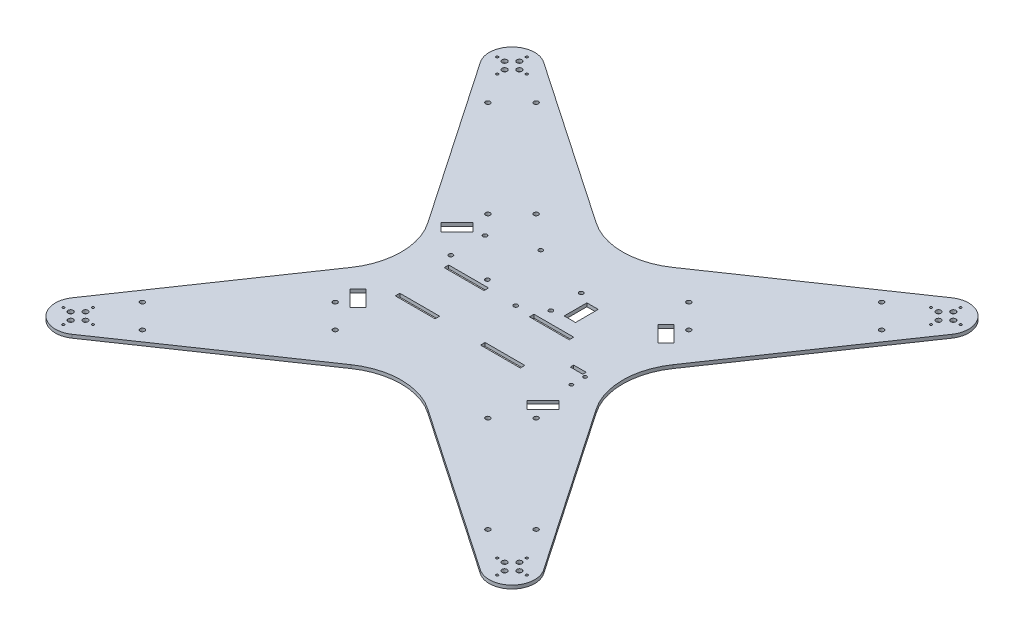
from build123d import *

# Parameters (mm, degrees)
SKETCH1_R           = 1
SKETCH1_R_2         = 2.25
SKETCH1_R_3         = 2
BOSS_EXTRUDE1_DEPTH = 3
CIRPATTERN1_COUNT   = 4
SKETCH2_R           = 1.5
SKETCH2_R_2         = 1.8
SKETCH2_W           = 35
SKETCH2_H           = 4
CUT_EXTRUDE1_DEPTH  = 299.299357146
FILLET1_R           = 60
SKETCH6_W           = 10
SKETCH6_H           = 20
CUT_EXTRUDE2_DEPTH  = 10
SKETCH7_W           = 11
SKETCH7_H           = 3
CUT_EXTRUDE3_DEPTH  = 299.299357146


with BuildPart() as part:
    # Sketch1 → Boss-Extrude1 (new body)
    with BuildSketch(Plane(origin=(0, 0, 0), x_dir=(1, 0, 0), z_dir=(0, 1, 0))):
        with BuildLine():
            Line((0, 84.852813742), (179.645786322, 207.439075031))
            ThreePointArc((179.645786322, 207.439075031), (205.060966544, 205.060966544), (207.439075031, 179.645786322))
            Line((207.439075031, 179.645786322), (84.852813742, 0))
            Line((84.852813742, 0), (0, 0))
            Line((0, 0), (0, 84.852813742))
        make_face()
        with Locations(Location((177.91883092, 190.91883092, 0), (0, 0, 270))):
            Circle(SKETCH1_R, mode=Mode.SUBTRACT)
        with Locations(Location((190.91883092, 203.91883092, 0), (0, 0, 270))):
            Circle(SKETCH1_R, mode=Mode.SUBTRACT)
        with Locations(Location((203.91883092, 190.91883092, 0), (0, 0, 270))):
            Circle(SKETCH1_R, mode=Mode.SUBTRACT)
        with Locations(Location((197.41883092, 190.91883092, 0), (0, 0, 270))):
            Circle(SKETCH1_R_2, mode=Mode.SUBTRACT)
        with Locations(Location((190.91883092, 197.41883092, 0), (0, 0, 270))):
            Circle(SKETCH1_R_2, mode=Mode.SUBTRACT)
        with Locations(Location((184.41883092, 190.91883092, 0), (0, 0, 270))):
            Circle(SKETCH1_R_2, mode=Mode.SUBTRACT)
        with Locations(Location((190.91883092, 184.41883092, 0), (0, 0, 270))):
            Circle(SKETCH1_R_2, mode=Mode.SUBTRACT)
        with Locations(Location((190.91883092, 177.91883092, 0), (0, 0, 270))):
            Circle(SKETCH1_R, mode=Mode.SUBTRACT)
        with Locations(Location((152.027957955, 173.241161391, 0), (0, 0, 270))):
            Circle(SKETCH1_R_3, mode=Mode.SUBTRACT)
        with Locations(Location((173.241161391, 152.027957955, 0), (0, 0, 270))):
            Circle(SKETCH1_R_3, mode=Mode.SUBTRACT)
        with Locations(Location((67.175144213, 88.388347648, 0), (0, 0, 270))):
            Circle(SKETCH1_R_3, mode=Mode.SUBTRACT)
        with Locations(Location((88.388347648, 67.175144213, 0), (0, 0, 270))):
            Circle(SKETCH1_R_3, mode=Mode.SUBTRACT)
    boss_extrude1 = extrude(amount=BOSS_EXTRUDE1_DEPTH)

    # CirPattern1: Boss-Extrude1 ×4 about axis
    cirpattern1_axis = Axis((0, 0, 0), (0, 1, 0))
    for i in range(1, CIRPATTERN1_COUNT):
        add(boss_extrude1.rotate(cirpattern1_axis, i * 360 / CIRPATTERN1_COUNT))

    # Sketch2 → Cut-Extrude1 (cut, through all)
    with BuildSketch(Plane(origin=(0, 3, 0), x_dir=(1, 0, 0), z_dir=(0, 1, 0))):
        with Locations(Location((78.536494873, -14.223633123, 0), (0, 0, 270))):
            Circle(SKETCH2_R)
        with Locations(Location((78.501168955, -26.223633123, 0), (0, 0, 270))):
            Circle(SKETCH2_R)
        with Locations(Location((12.881434281, 21.278805396, 0), (0, 0, 270))):
            Circle(SKETCH2_R_2)
        with Locations(Location((12.881434281, 48.01791892, 0), (0, 0, 270))):
            Circle(SKETCH2_R_2)
        with Locations(Location((-38.485846848, 16.889912116, 0), (0, 0, 270))):
            Circle(SKETCH2_R_2)
        with Locations(Location((-37.569525332, 62.827189776, 0), (0, 0, 270))):
            Circle(SKETCH2_R_2)
        with Locations(Location((-73.242055549, 49.452085076, 0), (0, 0, 270))):
            Circle(SKETCH2_R_2)
        with Locations(Location((-6.306632568, 9.567397571, 0), (0, 0, 270))):
            Circle(SKETCH2_R_2)
        with Locations(Location((-73.242055549, 19.452085076, 0), (0, 0, 270))):
            Circle(SKETCH2_R_2)
        with Locations((-49.231294494, 9.058974397)):
            Rectangle(SKETCH2_W, SKETCH2_H)
        with Locations((25.768705506, 9.058974397)):
            Rectangle(SKETCH2_W, SKETCH2_H)
        with Locations((-49.231294494, -33.973204669)):
            Rectangle(SKETCH2_W, SKETCH2_H)
        with Locations((25.768705506, -33.973204669)):
            Rectangle(SKETCH2_W, SKETCH2_H)
    extrude(amount=-CUT_EXTRUDE1_DEPTH, mode=Mode.SUBTRACT)

    # Fillet1
    fillet1_edges = [part.edges().sort_by_distance(p)[0] for p in [
        (-84.852813742, 1.5, 0),
        (0, 1.5, -84.852813742),
        (0, 1.5, 84.852813742),
        (84.852813742, 1.5, 0),
    ]]
    fillet(fillet1_edges, radius=FILLET1_R)

    # Sketch6 → Cut-Extrude2 (cut)
    with BuildSketch(Plane.XZ):
        Polygon((-91.923881554, 50.639610307), (-77.781745931, 64.781745931), (-70.710678119, 57.710678119), (-84.852813742, 43.568542495), align=None)
        Polygon((-102.530483272, -40.033008589), (-95.45941546, -32.961940777), (-81.317279836, -47.104076401), (-88.388347648, -54.175144213), align=None)
        Polygon((77.781745931, -64.781745931), (70.710678119, -57.710678119), (84.852813742, -43.568542495), (91.923881554, -50.639610307), align=None)
        Polygon((84.852813742, 43.568542495), (70.710678119, 57.710678119), (77.781745931, 64.781745931), (91.923881554, 50.639610307), align=None)
        with Locations((27.881434281, -33.01791892)):
            Rectangle(SKETCH6_W, SKETCH6_H)
    extrude(amount=-CUT_EXTRUDE2_DEPTH, mode=Mode.SUBTRACT)

    # Sketch7 → Cut-Extrude3 (cut, through all)
    with BuildSketch(Plane(origin=(0, 3, 0), x_dir=(1, 0, 0), z_dir=(0, 1, 0))):
        with Locations((70.036494873, -11.723633123)):
            Rectangle(SKETCH7_W, SKETCH7_H)
    extrude(amount=-CUT_EXTRUDE3_DEPTH, mode=Mode.SUBTRACT)


solid = part.part
